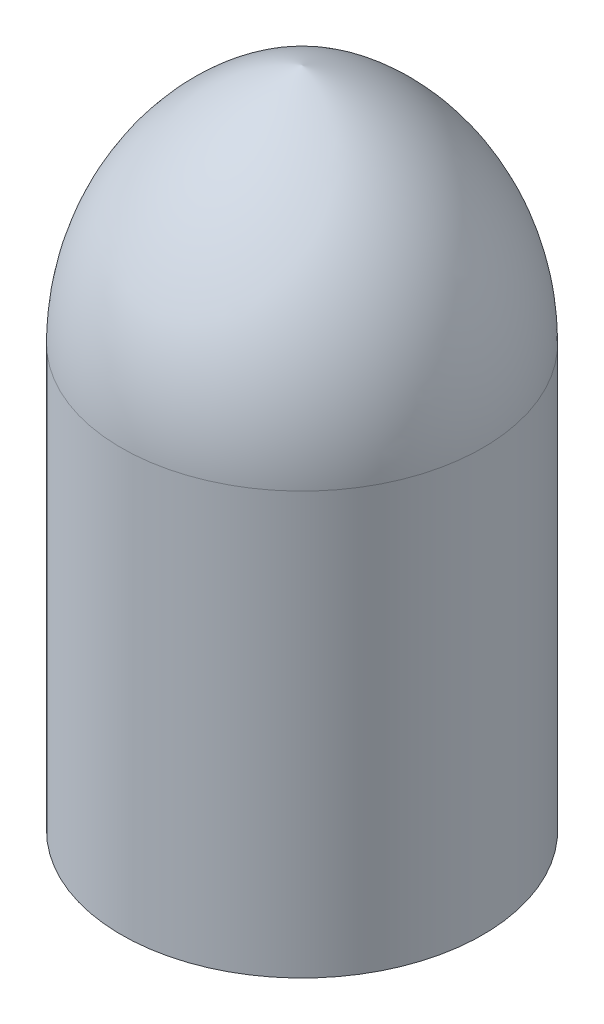
from build123d import *

# Parameters (mm, degrees)
SHELL3_T = -2


with BuildPart() as part:
    # Sketch1 → Revolve2 (revolve)
    with BuildSketch(Plane.XY, mode=Mode.PRIVATE) as revolve2_sk:
        with BuildLine():
            Line((0, 0), (60, 0))
            Line((60, 0), (60, 140))
            ThreePointArc((60, 140), (43.333333333, 190), (0, 220))
            Line((0, 220), (0, 0))
        make_face()
    revolve(revolve2_sk.sketch.rotate(Axis((0, 220, 0), (0, -1, 0)), 180), axis=Axis((0, 220, 0), (0, -1, 0)))

    # Shell3
    shell3_openings = [part.faces().sort_by_distance(p)[0] for p in [
        (0, 0, 0),
    ]]
    offset(amount=SHELL3_T, openings=shell3_openings, kind=Kind.INTERSECTION)


solid = part.part
